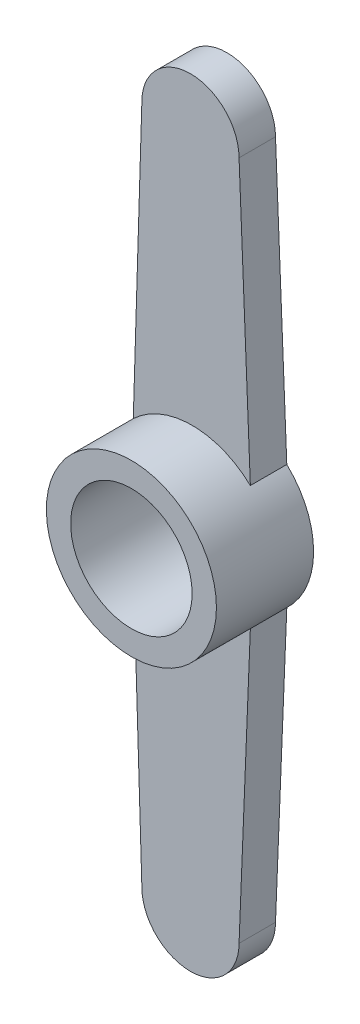
from build123d import *

# Parameters (mm, degrees)
ESQUISSE1_R        = 3.5
ESQUISSE1_R_2      = 2.5
BOSS_EXTRU_1_DEPTH = 4
BOSS_EXTRU_2_DEPTH = 1.5


with BuildPart() as part:
    # Esquisse1 → Boss.-Extru.1 (new body)
    with BuildSketch(Plane.XY):
        Circle(ESQUISSE1_R)
        Circle(ESQUISSE1_R_2, mode=Mode.SUBTRACT)
    extrude(amount=BOSS_EXTRU_1_DEPTH)

    # Esquisse1<3> → Boss.-Extru.2 (add)
    with BuildSketch(Plane.XY):
        with BuildLine():
            Line((-2.068537469, 14), (-2.42213609, 2.526510788))
            ThreePointArc((-2.42213609, 2.526510788), (-0.017735252, 3.499955066), (2.396407287, 2.550927696))
            Line((2.396407287, 2.550927696), (1.931462531, 14))
            ThreePointArc((1.931462531, 14), (-0.068537469, 16), (-2.068537469, 14))
        make_face()
        with BuildLine():
            ThreePointArc((2.396407287, -2.550927696), (-0.017735252, -3.499955066), (-2.42213609, -2.526510788))
            Line((-2.42213609, -2.526510788), (-2.068537469, -14))
            ThreePointArc((-2.068537469, -14), (-0.068537469, -16), (1.931462531, -14))
            Line((1.931462531, -14), (2.396407287, -2.550927696))
        make_face()
    extrude(amount=BOSS_EXTRU_2_DEPTH)


solid = part.part
